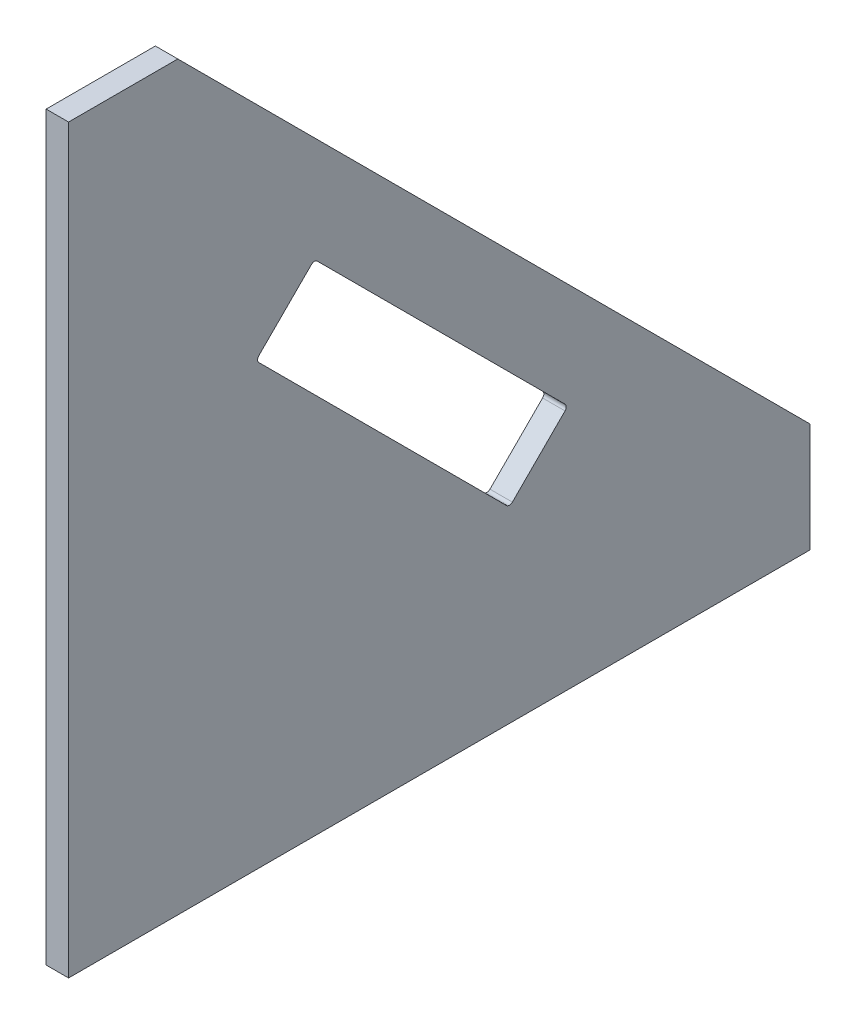
from build123d import *

# Parameters (mm, degrees)
BOSS_EXTRUDE1_DEPTH = 18.25625
CUT_EXTRUDE2_DEPTH  = 854.319644485
FILLET2_R           = 3.3782


with BuildPart() as part:
    # Sketch1 → Boss-Extrude1 (new body)
    with BuildSketch(Plane(origin=(0, 0, 0), x_dir=(0, 0, -1), z_dir=(1, 0, 0))):
        Polygon((0, 0), (0, 603.25), (88.9, 603.25), (603.25, 88.9), (603.25, 0), align=None)
    extrude(amount=BOSS_EXTRUDE1_DEPTH)

    # Sketch7 → Cut-Extrude2 (cut, through all)
    with BuildSketch(Plane(origin=(18.25625, 0, 0), x_dir=(0, 0, -1), z_dir=(1, 0, 0))):
        Polygon((200.025, 406.4), (406.4, 200.025), (358.775, 152.4), (152.4, 358.775), align=None)
    extrude(amount=-CUT_EXTRUDE2_DEPTH, mode=Mode.SUBTRACT)

    # Fillet2
    fillet2_edges = [part.edges().sort_by_distance(p)[0] for p in [
        (9.128125, 358.775, -152.4),
        (9.128125, 406.4, -200.025),
        (9.128125, 200.025, -406.4),
        (9.128125, 152.4, -358.775),
    ]]
    fillet(fillet2_edges, radius=FILLET2_R)


solid = part.part
